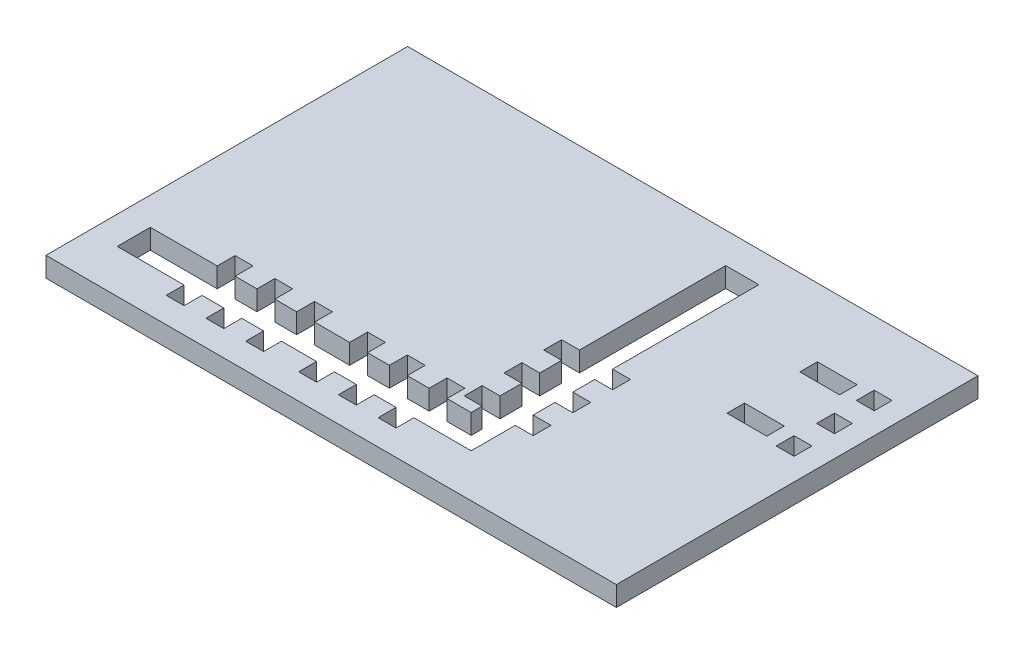
from build123d import *

# Parameters (mm, degrees)
SKETCH1_W           = 86.120484183
SKETCH1_H           = 54.608623026
SKETCH1_W_2         = 2.7
SKETCH1_H_2         = 2.7
SKETCH1_W_3         = 6
SKETCH1_H_3         = 2.65
BOSS_EXTRUDE1_DEPTH = 3


with BuildPart() as part:
    # Sketch1 → Boss-Extrude1 (new body)
    with BuildSketch(Plane(origin=(0, 0, 0), x_dir=(1, 0, 0), z_dir=(0, 1, 0))):
        with Locations((155.479789649, -59.671038124)):
            Rectangle(SKETCH1_W, SKETCH1_H)
        with Locations((193.834702188, -55.435925566)):
            Rectangle(SKETCH1_W_2, SKETCH1_H_2, mode=Mode.SUBTRACT)
        with Locations((193.933836211, -49.435925566)):
            Rectangle(SKETCH1_W_2, SKETCH1_H_2, mode=Mode.SUBTRACT)
        with Locations((193.933836211, -43.435925566)):
            Rectangle(SKETCH1_W_2, SKETCH1_H_2, mode=Mode.SUBTRACT)
        with Locations((187.484702188, -54.885926943)):
            Rectangle(SKETCH1_W_3, SKETCH1_H_3, mode=Mode.SUBTRACT)
        with Locations((187.583836211, -43.985925566)):
            Rectangle(SKETCH1_W_3, SKETCH1_H_3, mode=Mode.SUBTRACT)
        Polygon((129.433836211, -75.435925566), (132.733836211, -75.435925566), (132.733836211, -72.735925566), (135.433836211, -72.735925566), (135.433836211, -75.435925566), (138.733836211, -75.435925566), (138.733836211, -72.735925566), (141.433836211, -72.735925566), (141.433836211, -75.435925566), (146.733836211, -75.435925566), (146.733836211, -72.735925566), (149.433836211, -72.735925566), (149.433836211, -75.435925566), (152.733836211, -75.435925566), (152.733836211, -72.735925566), (155.433836211, -72.735925566), (155.433836211, -75.435925566), (158.733836211, -75.435925566), (158.733836211, -72.735925566), (161.433836211, -72.735925566), (161.433836211, -75.435925566), (165.083836211, -75.435925566), (165.083836211, -73.785925566), (162.383836211, -73.785925566), (162.383836211, -71.085925566), (165.083836211, -71.085925566), (165.083836211, -67.785925566), (162.383836211, -67.785925566), (162.383836211, -65.085925566), (165.083836211, -65.085925566), (165.083836211, -61.785925566), (162.383836211, -61.785925566), (162.383836211, -59.085925566), (165.083836211, -59.085925566), (165.083836211, -37.002032915), (170.083836211, -37.002032915), (170.083836211, -59.085925566), (172.783836211, -59.085925566), (172.783836211, -61.785925566), (170.083836211, -61.785925566), (170.083836211, -65.085925566), (172.783836211, -65.085925566), (172.783836211, -67.785925566), (170.083836211, -67.785925566), (170.083836211, -71.085925566), (172.783836211, -71.085925566), (172.783836211, -73.785925566), (170.083836211, -73.785925566), (170.083836211, -75.435925566), (170.083836211, -80.435925566), (161.433836211, -80.435925566), (161.433836211, -83.135925566), (158.733836211, -83.135925566), (158.733836211, -80.435925566), (155.433836211, -80.435925566), (155.433836211, -83.135925566), (152.733836211, -83.135925566), (152.733836211, -80.435925566), (149.433836211, -80.435925566), (149.433836211, -83.135925566), (146.733836211, -83.135925566), (146.733836211, -80.435925566), (141.433836211, -80.435925566), (141.433836211, -83.135925566), (138.733836211, -83.135925566), (138.733836211, -80.435925566), (135.433836211, -80.435925566), (135.433836211, -83.135925566), (132.733836211, -83.135925566), (132.733836211, -80.435925566), (129.433836211, -80.435925566), (129.433836211, -83.135925566), (126.733836211, -83.135925566), (126.733836211, -80.435925566), (116.63506554, -80.435925566), (116.63506554, -75.435925566), (126.733836211, -75.435925566), (126.733836211, -72.735925566), (129.433836211, -72.735925566), align=None, mode=Mode.SUBTRACT)
    extrude(amount=BOSS_EXTRUDE1_DEPTH)


solid = part.part
